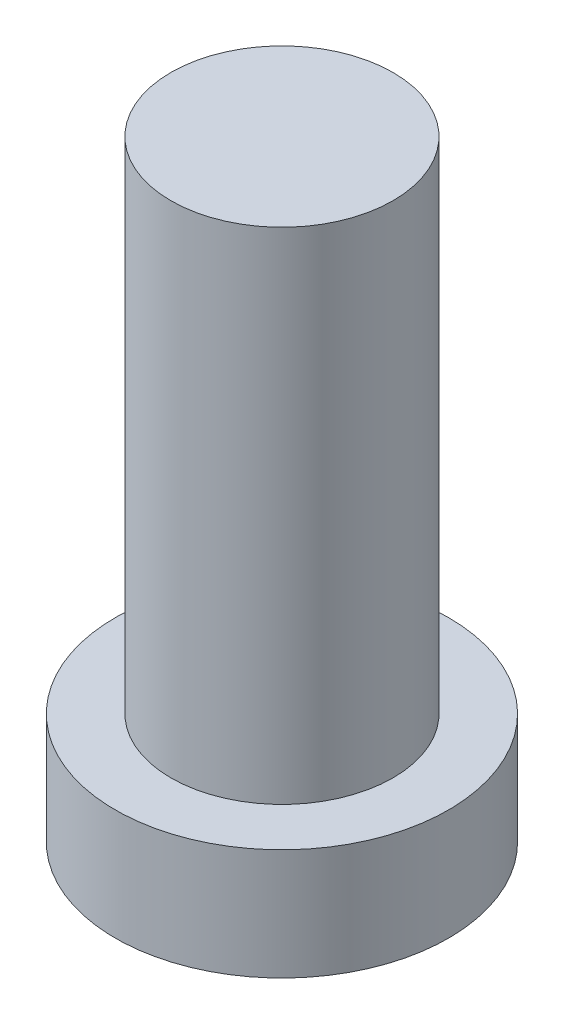
from build123d import *

# Parameters (mm, degrees)
SKETCH1_R           = 2.54
BOSS_EXTRUDE1_DEPTH = 11.43
SKETCH2_R           = 3.81
BOSS_EXTRUDE2_DEPTH = 2.54


with BuildPart() as part:
    # Sketch1 → Boss-Extrude1 (new body)
    with BuildSketch(Plane(origin=(0, 0, 0), x_dir=(1, 0, 0), z_dir=(0, 1, 0))):
        with Locations(Location((0, 0, 0), (0, 0, 270))):
            Circle(SKETCH1_R)
    extrude(amount=BOSS_EXTRUDE1_DEPTH)

    # Sketch2 → Boss-Extrude2 (add)
    with BuildSketch(Plane.XZ):
        with Locations(Location((0, 0, 0), (0, 0, 270))):
            Circle(SKETCH2_R)
    extrude(amount=BOSS_EXTRUDE2_DEPTH)


solid = part.part
